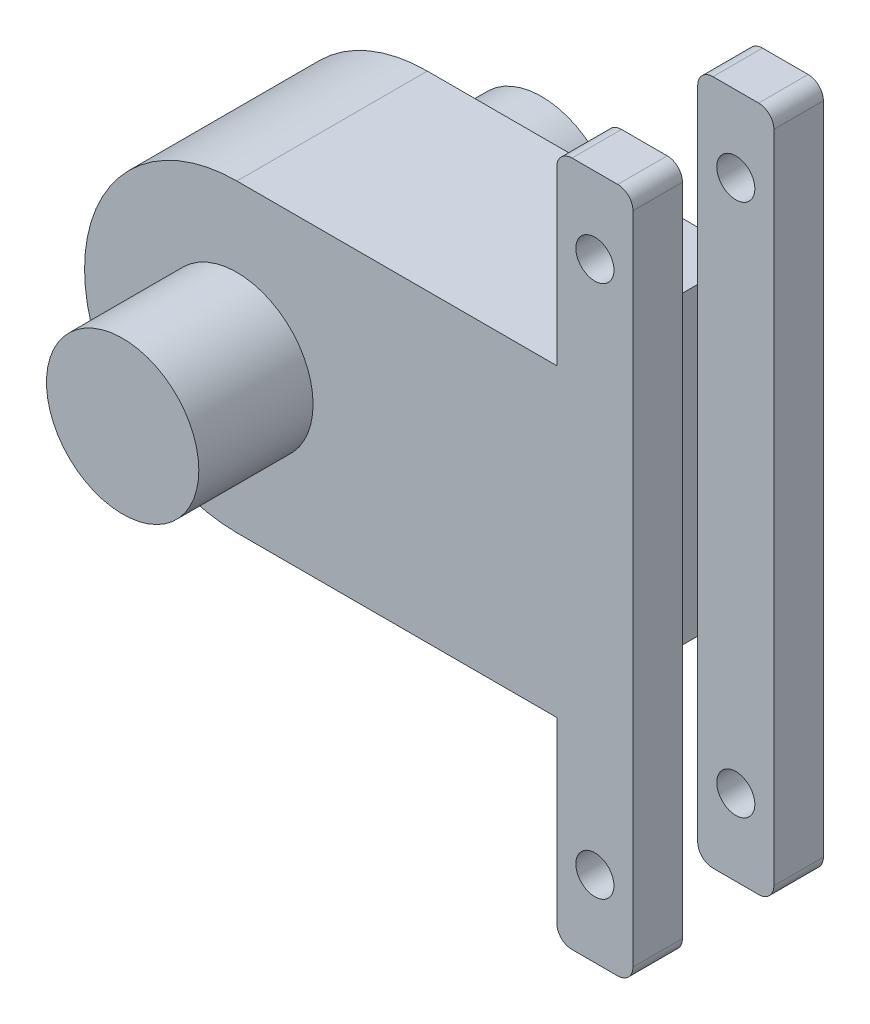
from build123d import *

# Parameters (mm, degrees)
SKETCH1_R               = 2.5
BOSS_EXTRUDE1_DEPTH     = 25
SKETCH2_R               = 10
BOSS_EXTRUDE2_DEPTH     = 15
CUT_EXTRUDE1_DEPTH      = 112.373246339
CUT_EXTRUDE1_DEPTH_BACK = 112.373246339
SKETCH3_W               = 10.01573238
SKETCH3_H               = 12
FILLET2_R               = 2


with BuildPart() as part:
    # Sketch1 → Boss-Extrude1 (new body)
    with BuildSketch(Plane.XY):
        with BuildLine():
            Line((42, -45), (42, -19.616886698))
            Line((42, -19.616886698), (0, -19.616886698))
            ThreePointArc((0, -19.616886698), (-20, 0.383113302), (0, 20.383113302))
            Line((0, 20.383113302), (42, 20.383113302))
            Line((42, 20.383113302), (42, 45))
            Line((42, 45), (52, 45))
            Line((52, 45), (52, -45))
            Line((52, -45), (42, -45))
        make_face()
        with Locations((47, 35)):
            Circle(SKETCH1_R, mode=Mode.SUBTRACT)
        with Locations(Location((47, -35, 0), (0, 0, 180))):
            Circle(SKETCH1_R, mode=Mode.SUBTRACT)
    extrude(amount=BOSS_EXTRUDE1_DEPTH)

    # Sketch2 → Boss-Extrude2 (add)
    with BuildSketch(Plane.XY.offset(25)):
        Circle(SKETCH2_R)
    boss_extrude2 = extrude(amount=BOSS_EXTRUDE2_DEPTH)

    # Mirror1: Boss-Extrude2 across plane
    add(boss_extrude2.mirror(Plane.XY.offset(12.5)))

    # Sketch3 → Cut-Extrude1 (cut, two sides: drawn at the far end of the back side and taken through both)
    with BuildSketch(Plane(origin=(0, 45, 0), x_dir=(1, 0, 0), z_dir=(0, 1, 0)).offset(-CUT_EXTRUDE1_DEPTH_BACK)):
        with Locations((47.00786619, -12.5)):
            Rectangle(SKETCH3_W, SKETCH3_H)
    extrude(amount=CUT_EXTRUDE1_DEPTH + CUT_EXTRUDE1_DEPTH_BACK, mode=Mode.SUBTRACT)

    # Fillet2
    fillet2_edges = [part.edges().sort_by_distance(p)[0] for p in [
        (42, 45, 21.75),
        (52, 45, 21.75),
        (52, -45, 21.75),
        (42, -45, 21.75),
        (42, 45, 3.25),
        (52, 45, 3.25),
        (52, -45, 3.25),
        (42, -45, 3.25),
    ]]
    fillet(fillet2_edges, radius=FILLET2_R)


solid = part.part
